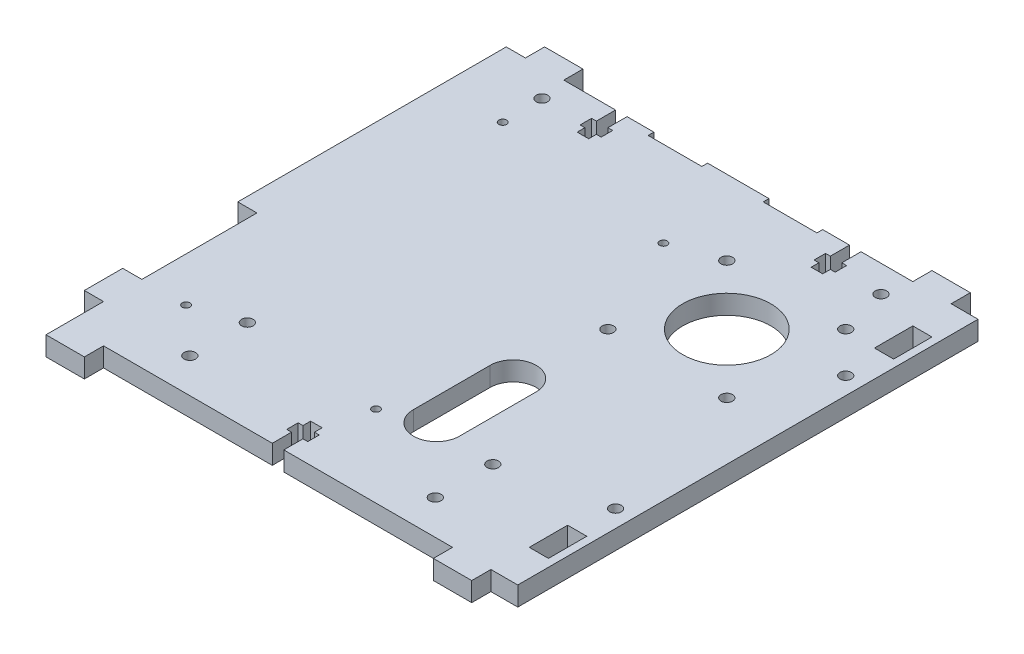
from build123d import *

# Parameters (mm, degrees)
SKETCH2_W           = 121
SKETCH2_H           = 120
SKETCH2_R           = 11.5
SKETCH2_R_2         = 1.5
SKETCH2_R_3         = 1
BOSS_EXTRUDE1_DEPTH = 5
SKETCH3_W           = 10
SKETCH3_H           = 5
SKETCH3_W_2         = 2
SKETCH3_H_2         = 120
BOSS_EXTRUDE2_DEPTH = 5
SKETCH4_R           = 1.5
SKETCH4_W           = 5
SKETCH4_H           = 10
SKETCH4_H_2         = 30
SKETCH4_W_2         = 14
SKETCH4_H_3         = 1.5
CUT_EXTRUDE1_DEPTH  = 175.043098111


with BuildPart() as part:
    # Sketch2 → Boss-Extrude1 (new body)
    with BuildSketch(Plane(origin=(0, 0, 0), x_dir=(1, 0, 0), z_dir=(0, 1, 0))):
        with Locations((-60.5, 60)):
            Rectangle(SKETCH2_W, SKETCH2_H)
        with Locations(Location((-28.5, 85, 0), (0, 0, 270))):
            Circle(SKETCH2_R, mode=Mode.SUBTRACT)
        with Locations(Location((-44, 100.5, 0), (0, 0, 270))):
            Circle(SKETCH2_R_2, mode=Mode.SUBTRACT)
        with Locations(Location((-13, 100.5, 0), (0, 0, 270))):
            Circle(SKETCH2_R_2, mode=Mode.SUBTRACT)
        with Locations(Location((-13, 69.5, 0), (0, 0, 270))):
            Circle(SKETCH2_R_2, mode=Mode.SUBTRACT)
        with Locations(Location((-44, 69.5, 0), (0, 0, 270))):
            Circle(SKETCH2_R_2, mode=Mode.SUBTRACT)
        with Locations(Location((-92.5, 24, 0), (0, 0, 270))):
            Circle(SKETCH2_R_2, mode=Mode.SUBTRACT)
        with Locations(Location((-92.5, 9, 0), (0, 0, 270))):
            Circle(SKETCH2_R_2, mode=Mode.SUBTRACT)
        with Locations(Location((-28.5, 9, 0), (0, 0, 90))):
            Circle(SKETCH2_R_2, mode=Mode.SUBTRACT)
        with Locations(Location((-28.5, 24, 0), (0, 0, 90))):
            Circle(SKETCH2_R_2, mode=Mode.SUBTRACT)
        with Locations(Location((-104.46, 19.97, 0), (0, 0, 270))):
            Circle(SKETCH2_R_3, mode=Mode.SUBTRACT)
        with Locations(Location((-104.46, 102.52, 0), (0, 0, 270))):
            Circle(SKETCH2_R_3, mode=Mode.SUBTRACT)
        with Locations(Location((-56.2, 96.17, 0), (0, 0, 270))):
            Circle(SKETCH2_R_3, mode=Mode.SUBTRACT)
        with Locations(Location((-56.2, 21.24, 0), (0, 0, 270))):
            Circle(SKETCH2_R_3, mode=Mode.SUBTRACT)
    extrude(amount=BOSS_EXTRUDE1_DEPTH)

    # Sketch3 → Boss-Extrude2 (add)
    with BuildSketch(Plane(origin=(0, 5, 0), x_dir=(1, 0, 0), z_dir=(0, 1, 0))):
        with Locations((-111, 122.5)):
            Rectangle(SKETCH3_W, SKETCH3_H)
        with Locations((-10, 122.5)):
            Rectangle(SKETCH3_W, SKETCH3_H)
        with Locations((-10, -2.5)):
            Rectangle(SKETCH3_W, SKETCH3_H)
        with Locations((-111, -2.5)):
            Rectangle(SKETCH3_W, SKETCH3_H)
        with Locations((1, 60)):
            Rectangle(SKETCH3_W_2, SKETCH3_H_2)
    extrude(amount=-BOSS_EXTRUDE2_DEPTH)

    # Sketch4 → Cut-Extrude1 (cut, through all)
    with BuildSketch(Plane(origin=(0, 5, 0), x_dir=(1, 0, 0), z_dir=(0, 1, 0))):
        with Locations(Location((-2.5, 90, 0), (0, 0, 270))):
            Circle(SKETCH4_R)
        with Locations(Location((-2.5, 30, 0), (0, 0, 90))):
            Circle(SKETCH4_R)
        with Locations(Location((-16.3, 113, 0), (0, 0, 270))):
            Circle(SKETCH4_R)
        with Locations(Location((-104.7, 113, 0), (0, 0, 90))):
            Circle(SKETCH4_R)
        with Locations((-2.5, 105)):
            Rectangle(SKETCH4_W, SKETCH4_H)
        with Locations((-2.5, 15)):
            Rectangle(SKETCH4_W, SKETCH4_H)
        with Locations((-118.5, 35)):
            Rectangle(SKETCH4_W, SKETCH4_H_2)
        with Locations((-118.5, 5)):
            Rectangle(SKETCH4_W, SKETCH4_H)
        with Locations((-75.5, 119.25)):
            Rectangle(SKETCH4_W_2, SKETCH4_H_3)
        with Locations((-45.5, 119.25)):
            Rectangle(SKETCH4_W_2, SKETCH4_H_3)
        Polygon((-31.5, 120), (-31.5, 115), (-32.75, 115), (-32.75, 112), (-31.5, 112), (-31.5, 110), (-28.5, 110), (-28.5, 112), (-27.25, 112), (-27.25, 115), (-28.5, 115), (-28.5, 120), align=None)
        Polygon((-92.5, 120), (-89.5, 120), (-89.5, 115), (-88.25, 115), (-88.25, 112), (-89.5, 112), (-89.5, 110), (-92.5, 110), (-92.5, 112), (-93.75, 112), (-93.75, 115), (-92.5, 115), align=None)
        with BuildLine():
            Line((-51.2, 26), (-51.2, 46))
            ThreePointArc((-51.2, 46), (-45.2, 52), (-39.2, 46))
            Line((-39.2, 46), (-39.2, 26))
            ThreePointArc((-39.2, 26), (-45.2, 20), (-51.2, 26))
        make_face()
        Polygon((-62, 0), (-62, 5), (-63.25, 5), (-63.25, 8), (-62, 8), (-62, 10), (-59, 10), (-59, 8), (-57.75, 8), (-57.75, 5), (-59, 5), (-59, 0), align=None)
    extrude(amount=-CUT_EXTRUDE1_DEPTH, mode=Mode.SUBTRACT)


solid = part.part
